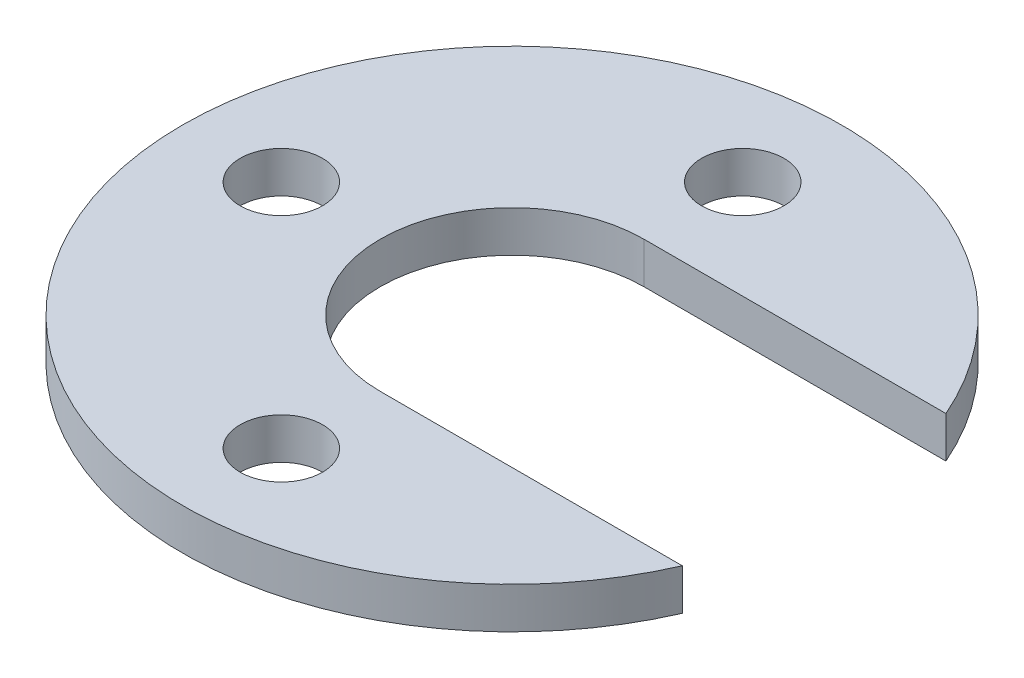
from build123d import *

# Parameters (mm, degrees)
SKETCH1_R           = 5
BOSS_EXTRUDE1_DEPTH = 5


with BuildPart() as part:
    # Sketch1 → Boss-Extrude1 (new body)
    with BuildSketch(Plane(origin=(0, 0, 0), x_dir=(1, 0, 0), z_dir=(0, 1, 0))):
        with BuildLine():
            Line((0, 16), (36.66060556, 16))
            ThreePointArc((36.66060556, 16), (-40, 0), (36.66060556, -16))
            Line((36.66060556, -16), (0, -16))
            ThreePointArc((0, -16), (-16, 0), (0, 16))
        make_face()
        with Locations(Location((0, 28, 0), (0, 0, 270))):
            Circle(SKETCH1_R, mode=Mode.SUBTRACT)
        with Locations(Location((0, -28, 0), (0, 0, 270))):
            Circle(SKETCH1_R, mode=Mode.SUBTRACT)
        with Locations(Location((-28, 0, 0), (0, 0, 270))):
            Circle(SKETCH1_R, mode=Mode.SUBTRACT)
    extrude(amount=BOSS_EXTRUDE1_DEPTH)


solid = part.part
